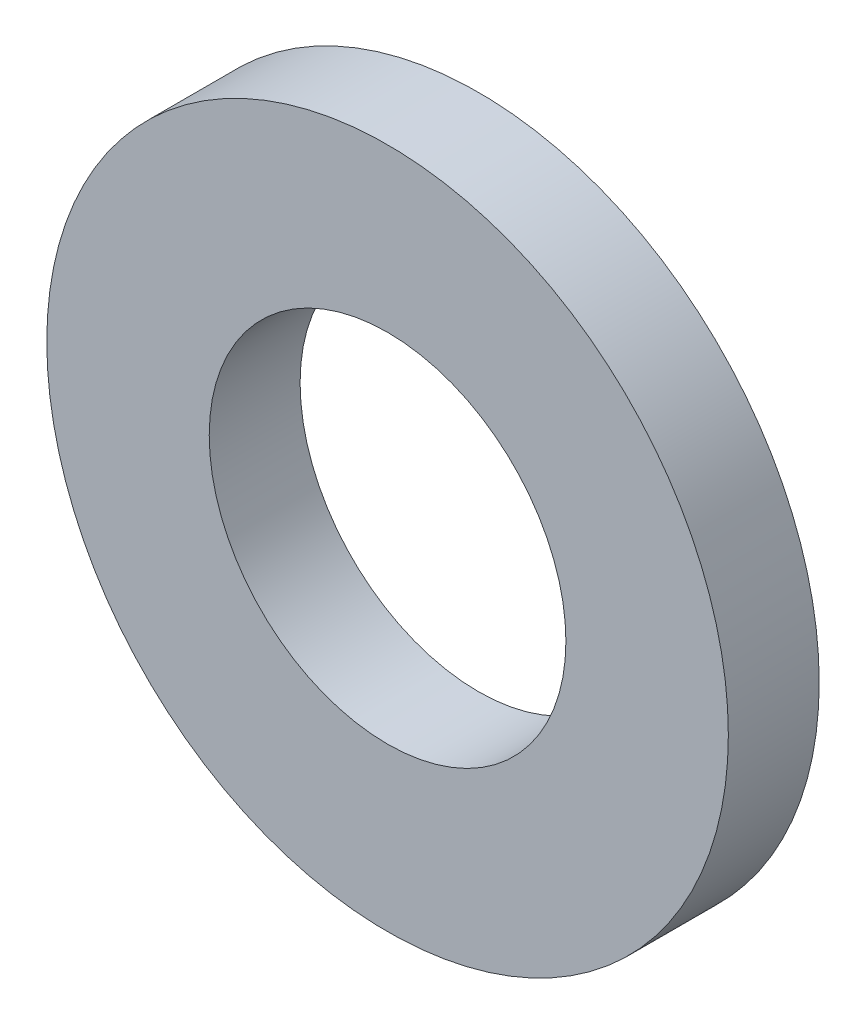
from build123d import *

# Parameters (mm, degrees)
SKETCH1_R          = 3
SKETCH1_R_2        = 1.57
BASE_EXTRUDE_DEPTH = 0.8


with BuildPart() as part:
    # Sketch1 → Base-Extrude (new body)
    with BuildSketch(Plane.XY):
        Circle(SKETCH1_R)
        Circle(SKETCH1_R_2, mode=Mode.SUBTRACT)
    extrude(amount=-BASE_EXTRUDE_DEPTH)


solid = part.part
